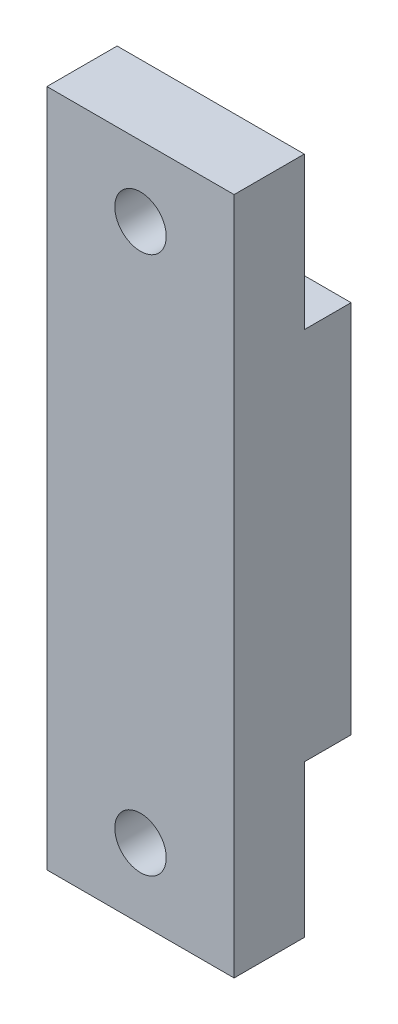
from build123d import *

# Parameters (mm, degrees)
SKETCH_1_W            = 8
SKETCH_1_H            = 29
EXTRUDE_268_DEPTH     = 3
SKETCH_2_W            = 8
SKETCH_2_H            = 16
EXTRUDE_388_DEPTH     = 2
CUT_EXTRUDE_597_REACH = 17.851
SKETCH_3_R            = 1.1


with BuildPart() as part:
    # 草图1 → Extrude 268 (new body)
    with BuildSketch(Plane.XY):
        Rectangle(SKETCH_1_W, SKETCH_1_H)
    extrude(amount=EXTRUDE_268_DEPTH)

    # 草图2 → Extrude 388 (add)
    with BuildSketch(Plane.XY):
        Rectangle(SKETCH_2_W, SKETCH_2_H)
    extrude(amount=-EXTRUDE_388_DEPTH)

    # 草图3 → Cut-Extrude 597 (cut, up to next)
    with BuildSketch(Plane.XY.offset(3), mode=Mode.PRIVATE) as cut_extrude_597_sk1:
        with Locations((0, 11.5)):
            Circle(SKETCH_3_R)
    cut_extrude_597_tool1 = extrude(cut_extrude_597_sk1.sketch, amount=-CUT_EXTRUDE_597_REACH, mode=Mode.PRIVATE) & part.part
    # 草图3 → Cut-Extrude 597 (cut, up to next)
    with BuildSketch(Plane.XY.offset(3), mode=Mode.PRIVATE) as cut_extrude_597_sk2:
        with Locations((0, -11.5)):
            Circle(SKETCH_3_R)
    cut_extrude_597_tool2 = extrude(cut_extrude_597_sk2.sketch, amount=-CUT_EXTRUDE_597_REACH, mode=Mode.PRIVATE) & part.part
    add(cut_extrude_597_tool1.solids().sort_by_distance((0, 11.5, 3))[0], mode=Mode.SUBTRACT)
    add(cut_extrude_597_tool2.solids().sort_by_distance((0, -11.5, 3))[0], mode=Mode.SUBTRACT)


solid = part.part
